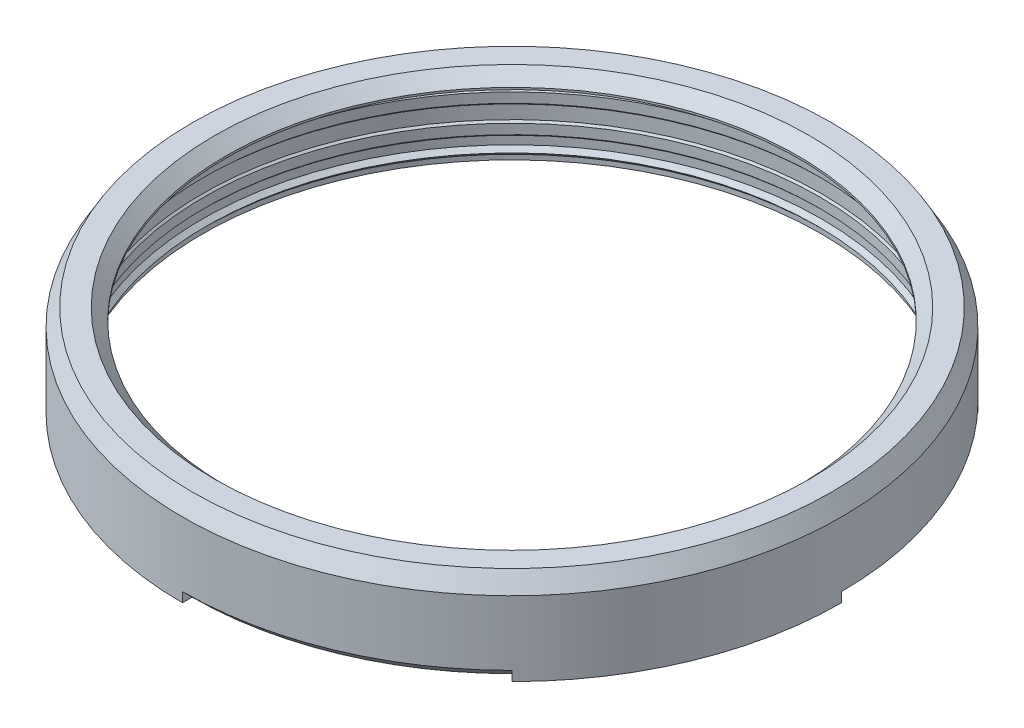
from build123d import *

# Parameters (mm, degrees)
SKETCH_1_R               = 34
EXTRUDE_1_DEPTH          = 2
SKETCH_3_R               = 29.5
CUT_EXTRUDE_1_DEPTH      = 50.112116631
CUT_EXTRUDE_START        = -0.6
SKETCH_4_R               = 34
CUT_EXTRUDE_2_DEPTH      = 0.6
CHAMFER_2_SIZE           = 1.732
CHAMFER_2_SIZE2          = 0.999970666
CHAMFER_3_SIZE           = 1.2
CUT_REVOLVE_1_ANGLE      = 45
PATTERN_CIRCULAR_1_COUNT = 4
SKETCH_6_R               = 30.78
SKETCH_6_R_2             = 30.32
EXTRUDE_2_DEPTH          = 0.5


with BuildPart() as part:
    # 草图1 → 凸台-拉伸1 (new body)
    with BuildSketch(Plane(origin=(0, 0, 0), x_dir=(1, 0, 0), z_dir=(0, 1, 0))):
        with Locations(Location((0, 0, 0), (0, 0, 270))):
            Circle(SKETCH_1_R)
    extrude(amount=EXTRUDE_1_DEPTH)

    # 草图2 → 旋转1 (revolve)
    with BuildSketch(Plane(origin=(0, 0, 0), x_dir=(0.499999999999999, 0, 0.8660254037844394), z_dir=(-0.8660254037844394, 0, 0.499999999999999)), mode=Mode.PRIVATE) as revolve_1_sk:
        with BuildLine():
            Line((31.93, -8), (31.93, -7.5))
            Line((31.93, -7.5), (31.505, -7.075))
            Line((31.505, -7.075), (31.93, -6.65))
            Line((31.93, -6.65), (31.93, -5.8))
            Line((31.93, -5.8), (31.74, -5.61))
            Line((31.74, -5.61), (31.74, -4.59))
            Line((31.74, -4.59), (31.93, -4.4))
            Line((31.93, -4.4), (31.93, -3))
            Line((31.93, -3), (31.74, -2.81))
            Line((31.74, -2.81), (31.74, -1.79))
            Line((31.74, -1.79), (31.93, -1.6))
            Line((31.93, -1.6), (31.93, -1.4))
            ThreePointArc((31.93, -1.4), (31.519949494, -0.410050506), (30.53, 0))
            Line((30.53, 0), (34, 0))
            Line((34, 0), (34, -8))
            Line((34, -8), (31.93, -8))
        make_face()
    revolve(revolve_1_sk.sketch.rotate(Axis((0, 0, 0), (0, 1, 0)), 150), axis=Axis((0, 0, 0), (0, 1, 0)))

    # 草图3 → 切除-拉伸1 (cut, through all)
    with BuildSketch(Plane(origin=(0, 2, 0), x_dir=(1, 0, 0), z_dir=(0, 1, 0))):
        with Locations(Location((0, 0, 0), (0, 0, 270))):
            Circle(SKETCH_3_R)
    extrude(amount=-CUT_EXTRUDE_1_DEPTH, mode=Mode.SUBTRACT)

    # 草图4 → 切除-拉伸2 (cut)
    with BuildSketch(Plane(origin=(0, 2, 0), x_dir=(1, 0, 0), z_dir=(0, 1, 0)).offset(CUT_EXTRUDE_START)):
        with Locations(Location((0, 0, 0), (0, 0, 90))):
            Circle(SKETCH_4_R)
    extrude(amount=CUT_EXTRUDE_2_DEPTH, mode=Mode.SUBTRACT)

    # 倒角2
    chamfer_2_edges = [part.edges().sort_by_distance(p)[0] for p in [
        (0, 1.4, -34),
    ]]
    chamfer_2_side = [part.faces().sort_by_distance(p)[0] for p in [
        (0, 0.7, -34),
    ]]
    chamfer(chamfer_2_edges, length=CHAMFER_2_SIZE, length2=CHAMFER_2_SIZE2, reference=chamfer_2_side[0])

    # 倒角3
    chamfer_3_edges = [part.edges().sort_by_distance(p)[0] for p in [
        (0, 1.4, -29.5),
    ]]
    chamfer(chamfer_3_edges, length=CHAMFER_3_SIZE)

    # 草图5 → 切除-旋转1 (revolve, cut)
    with BuildSketch(Plane.XY):
        Polygon((34, -8), (34, -7), (33, -8), align=None)
    cut_revolve_1 = revolve(axis=Axis((0, 0, 0), (0, 1, 0)), revolution_arc=CUT_REVOLVE_1_ANGLE, mode=Mode.SUBTRACT)

    # 阵列(圆周)1: 切除-旋转1 ×4 about axis
    pattern_circular_1_axis = Axis((0, 0, 0), (0, 1, 0))
    for i in range(1, PATTERN_CIRCULAR_1_COUNT):
        add(cut_revolve_1.rotate(pattern_circular_1_axis, i * 360 / PATTERN_CIRCULAR_1_COUNT), mode=Mode.SUBTRACT)

    # 草图6 → 凸台-拉伸2 (add)
    with BuildSketch(Plane.XZ):
        with Locations(Location((0, 0, 0), (0, 0, 270))):
            Circle(SKETCH_6_R)
        with Locations(Location((0, 0, 0), (0, 0, 270))):
            Circle(SKETCH_6_R_2, mode=Mode.SUBTRACT)
    extrude(amount=EXTRUDE_2_DEPTH)


solid = part.part
